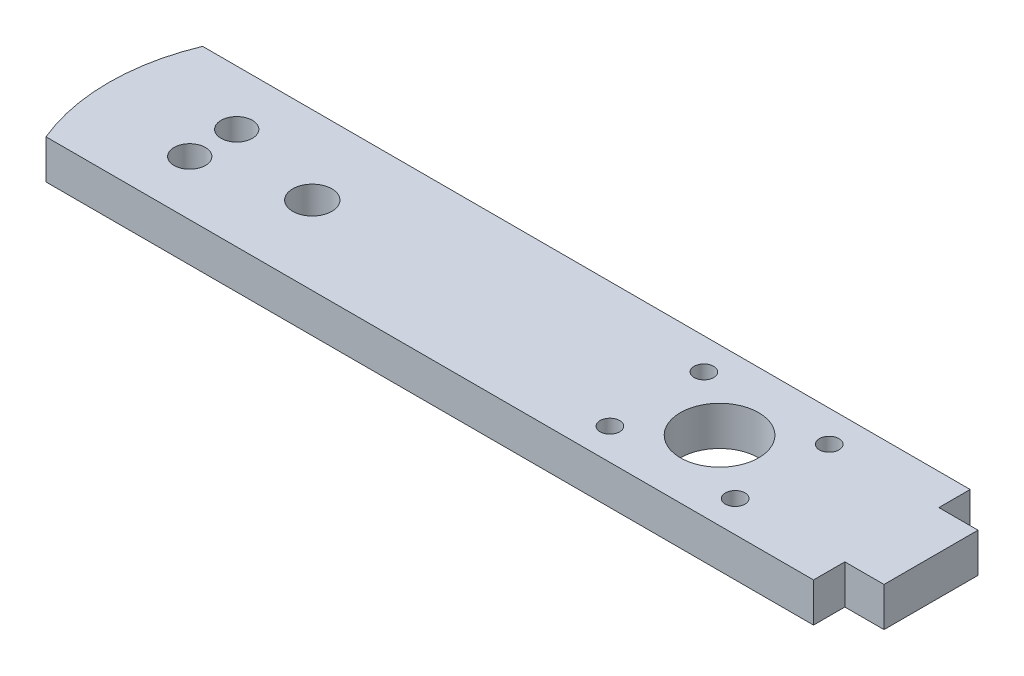
from build123d import *

# Parameters (mm, degrees)
SKETCH1_W                               = 140
SKETCH1_H                               = 20
SKETCH1_W_2                             = 5
SKETCH1_H_2                             = 12
BOSS_EXTRUDE1_DEPTH                     = 2.5
SKETCH2_R                               = 5
CUT_EXTRUDE1_DEPTH                      = 5
M3_TAPPED_HOLE2_D                       = 2.5
M3_TAPPED_HOLE2_CSINK_D                 = 3.05
M3_TAPPED_HOLE2_CSINK_ANGLE             = 90
F_5_0MM_DOWEL_HOLE1_D                   = 5
CBORE_FOR_M5_HEX_HEAD_BOLT2_D           = 3
CBORE_FOR_M5_HEX_HEAD_BOLT2_CBORE_D     = 4
CBORE_FOR_M5_HEX_HEAD_BOLT2_CBORE_DEPTH = 3
CUT_EXTRUDE2_DEPTH                      = 10


with BuildPart() as part:
    # Sketch1 → Boss-Extrude1 (new, symmetric)
    with BuildSketch(Plane(origin=(0, 0, 0), x_dir=(1, 0, 0), z_dir=(0, 1, 0))):
        Rectangle(SKETCH1_W, SKETCH1_H)
        with Locations((72.5, 0)):
            Rectangle(SKETCH1_W_2, SKETCH1_H_2)
    extrude(amount=BOSS_EXTRUDE1_DEPTH, both=True)

    # Sketch2 → Cut-Extrude1 (cut)
    with BuildSketch(Plane.XZ.offset(2.5)):
        with Locations(Location((48, 0, 0), (0, 0, 270))):
            Circle(SKETCH2_R)
    extrude(amount=-CUT_EXTRUDE1_DEPTH, mode=Mode.SUBTRACT)

    # M3 Tapped Hole2 (through all)
    with Locations(Plane(origin=(0, -2.5, 0), x_dir=(-1, 0, 0), z_dir=(0, -1, 0))):
        with Locations((-56, 6), (-40, 6), (-40, -6), (-56, -6)):
            CounterSinkHole(M3_TAPPED_HOLE2_D / 2, M3_TAPPED_HOLE2_CSINK_D / 2, counter_sink_angle=M3_TAPPED_HOLE2_CSINK_ANGLE)

    # Ø5.0mm Dowel Hole1 (through all)
    with Locations(Plane(origin=(0, -2.5, 0), x_dir=(-1, 0, 0), z_dir=(0, -1, 0))):
        with Locations((4, 0)):
            Hole(F_5_0MM_DOWEL_HOLE1_D / 2)

    # CBORE for M5 Hex Head Bolt2 (through all)
    with Locations(Plane(origin=(-16.649110641, 2.5, 3), x_dir=(0, 0, 1), z_dir=(0, 1, 0))):
        with Locations((0, 0), (-6, 0)):
            CounterBoreHole(CBORE_FOR_M5_HEX_HEAD_BOLT2_D / 2, CBORE_FOR_M5_HEX_HEAD_BOLT2_CBORE_D / 2, CBORE_FOR_M5_HEX_HEAD_BOLT2_CBORE_DEPTH)

    # Sketch29 → Cut-Extrude2 (cut)
    with BuildSketch(Plane(origin=(0, 2.5, 0), x_dir=(1, 0, 0), z_dir=(0, 1, 0))):
        with BuildLine():
            ThreePointArc((-28, -10), (-30, 0), (-28, 10))
            Line((-28, 10), (-70, 10))
            Line((-70, 10), (-70, -10))
            Line((-70, -10), (-28, -10))
        make_face()
    extrude(amount=-CUT_EXTRUDE2_DEPTH, mode=Mode.SUBTRACT)


solid = part.part
